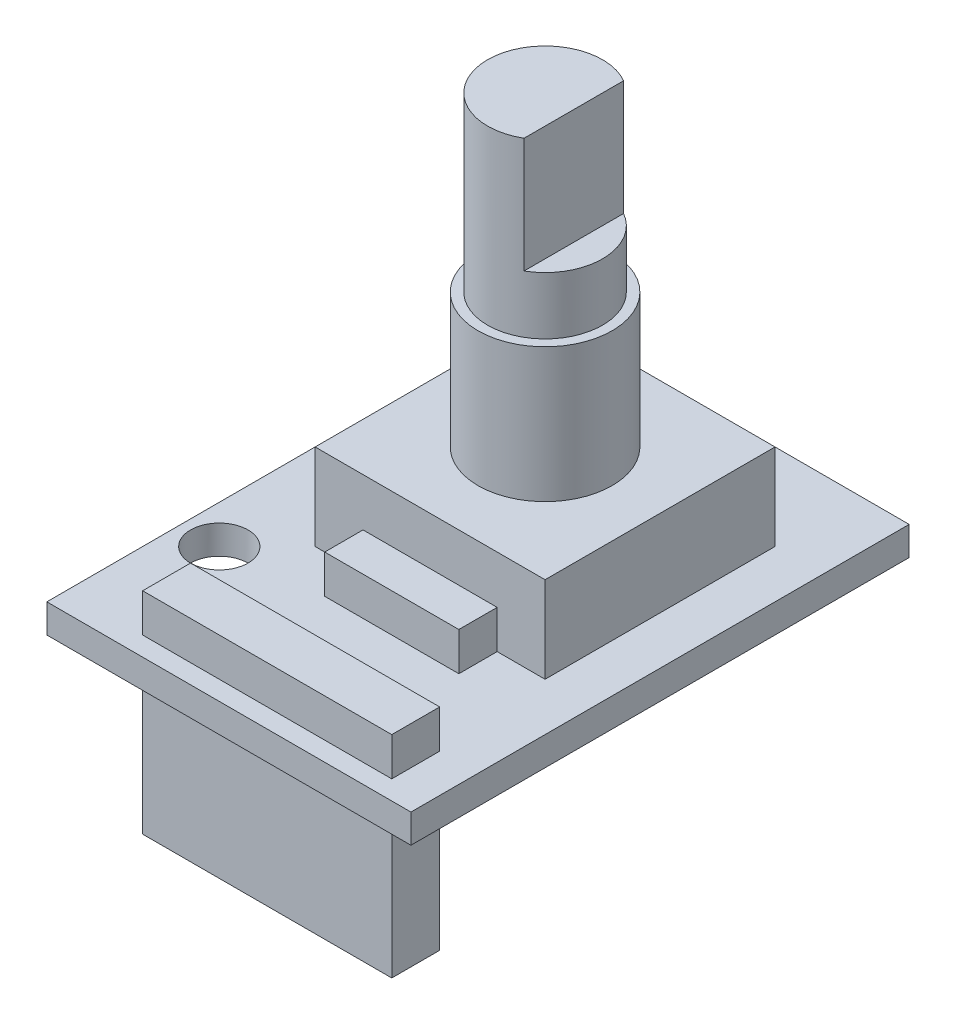
from build123d import *

# Parameters (mm, degrees)
SCHIZZO1_W                        = 19
SCHIZZO1_H                        = 26
ESTRUSIONE_ESTRUSIONE1_DEPTH      = 1.5
SCHIZZO2_W                        = 12
SCHIZZO2_H                        = 12
ESTRUSIONE_ESTRUSIONE2_DEPTH      = 4.5
SCHIZZO4_R                        = 3.5
ESTRUSIONE_ESTRUSIONE3_DEPTH      = 7
SCHIZZO5_R                        = 3
ESTRUSIONE_ESTRUSIONE4_DEPTH      = 9
TAGLIO_ESTRUSIONE1_DEPTH          = 6
SCHIZZO7_R                        = 1.5
TAGLIO_ESTRUSIONE2_DEPTH          = 6
ESTRUSIONE_ESTRUSIONE5_DEPTH      = 2
ESTRUSIONE_ESTRUSIONE5_DEPTH_BACK = 9
SCHIZZO8_W                        = 13
SCHIZZO8_H                        = 2.5
SCHIZZO9_W                        = 9.5
SCHIZZO9_H                        = 18.5
ESTRUSIONE_ESTRUSIONE6_DEPTH      = 1.5
SCHIZZO10_W                       = 7
SCHIZZO10_H                       = 2
ESTRUSIONE_ESTRUSIONE7_DEPTH      = 2


with BuildPart() as part:
    # Schizzo1 → Estrusione-Estrusione1 (new body)
    with BuildSketch(Plane(origin=(0, 0, 0), x_dir=(1, 0, 0), z_dir=(0, 1, 0))):
        Rectangle(SCHIZZO1_W, SCHIZZO1_H)
    extrude(amount=ESTRUSIONE_ESTRUSIONE1_DEPTH)

    # Schizzo2 → Estrusione-Estrusione2 (add)
    with BuildSketch(Plane(origin=(0, 1.5, 0), x_dir=(1, 0, 0), z_dir=(0, 1, 0))):
        with Locations((1, 2.5)):
            Rectangle(SCHIZZO2_W, SCHIZZO2_H)
    extrude(amount=ESTRUSIONE_ESTRUSIONE2_DEPTH)

    # Schizzo4 → Estrusione-Estrusione3 (add)
    with BuildSketch(Plane(origin=(0, 6, 0), x_dir=(1, 0, 0), z_dir=(0, 1, 0))):
        with Locations(Location((1, 2.5, 0), (0, 0, 270))):
            Circle(SCHIZZO4_R)
    extrude(amount=ESTRUSIONE_ESTRUSIONE3_DEPTH)

    # Schizzo5 → Estrusione-Estrusione4 (add)
    with BuildSketch(Plane(origin=(0, 13, 0), x_dir=(1, 0, 0), z_dir=(0, 1, 0))):
        with Locations(Location((1, 2.5, 0), (0, 0, 270))):
            Circle(SCHIZZO5_R)
    extrude(amount=ESTRUSIONE_ESTRUSIONE4_DEPTH)

    # Schizzo6 → Taglio-Estrusione1 (cut)
    with BuildSketch(Plane(origin=(0, 22, 0), x_dir=(1, 0, 0), z_dir=(0, 1, 0))):
        Polygon((2.5, 58.528036495), (2.5, 5.098076211), (2.5, -0.098076211), (2.5, -53.528036495), (109.359920567, -53.528036495), (109.359920567, 58.528036495), align=None)
    extrude(amount=-TAGLIO_ESTRUSIONE1_DEPTH, mode=Mode.SUBTRACT)

    # Schizzo7 → Taglio-Estrusione2 (cut)
    with BuildSketch(Plane(origin=(0, 1.5, 0), x_dir=(1, 0, 0), z_dir=(0, 1, 0))):
        with Locations(Location((-7.5, 7.5, 0), (0, 0, 270))):
            Circle(SCHIZZO7_R)
        with Locations(Location((-7.5, -6, 0), (0, 0, 270))):
            Circle(SCHIZZO7_R)
    extrude(amount=-TAGLIO_ESTRUSIONE2_DEPTH, mode=Mode.SUBTRACT)

    # Schizzo8 → Estrusione-Estrusione5 (add, two sides: drawn at the far end of the back side and taken through both)
    with BuildSketch(Plane(origin=(0, 1.5, 0), x_dir=(1, 0, 0), z_dir=(0, 1, 0)).offset(-ESTRUSIONE_ESTRUSIONE5_DEPTH_BACK)):
        with Locations((1, -10.75)):
            Rectangle(SCHIZZO8_W, SCHIZZO8_H)
    extrude(amount=ESTRUSIONE_ESTRUSIONE5_DEPTH + ESTRUSIONE_ESTRUSIONE5_DEPTH_BACK)

    # Schizzo9 → Estrusione-Estrusione6 (add)
    with BuildSketch(Plane.XZ):
        with Locations((1.75, -2.75)):
            Rectangle(SCHIZZO9_W, SCHIZZO9_H)
    extrude(amount=ESTRUSIONE_ESTRUSIONE6_DEPTH)

    # Schizzo10 → Estrusione-Estrusione7 (add)
    with BuildSketch(Plane(origin=(0, 1.5, 0), x_dir=(1, 0, 0), z_dir=(0, 1, 0))):
        with Locations((1, 9.5)):
            Rectangle(SCHIZZO10_W, SCHIZZO10_H)
        with Locations((1, -4.5)):
            Rectangle(SCHIZZO10_W, SCHIZZO10_H)
    extrude(amount=ESTRUSIONE_ESTRUSIONE7_DEPTH)


solid = part.part
